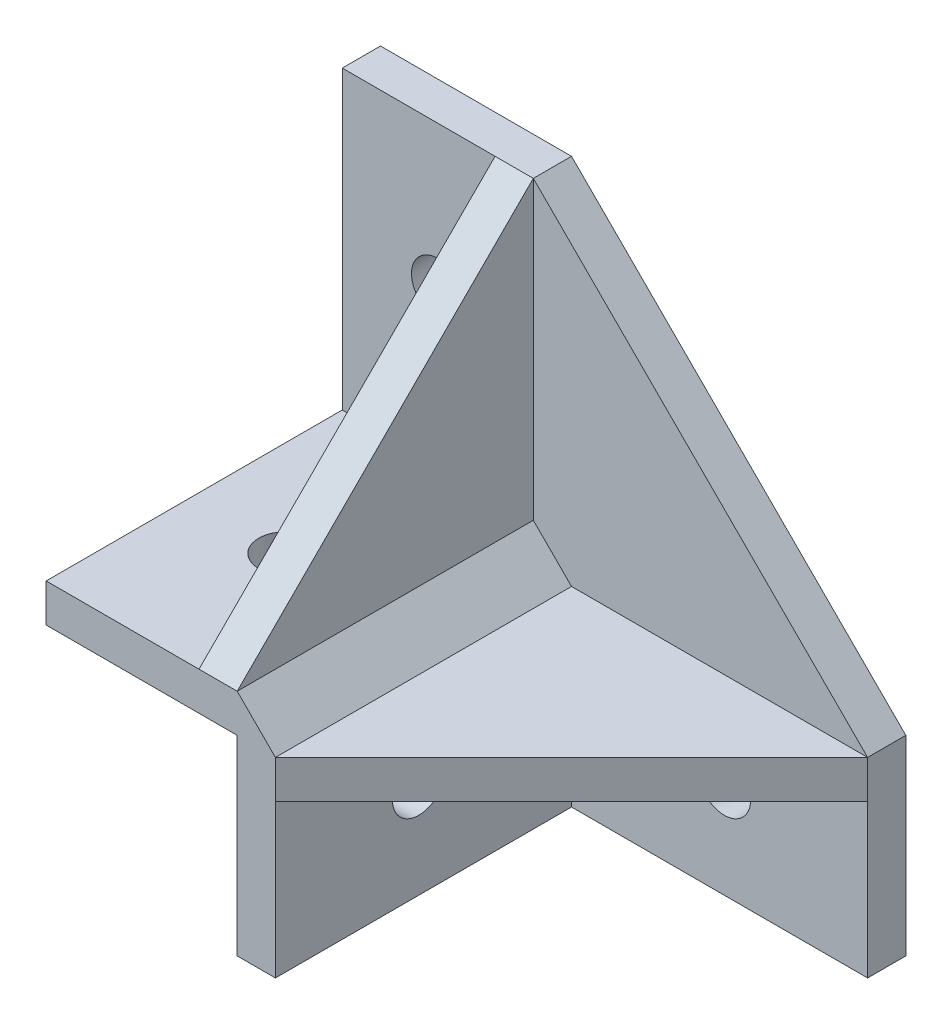
from build123d import *

# Parameters (mm, degrees)
BOSS_EXTRUDE1_DEPTH = 4
BOSS_EXTRUDE2_DEPTH = 31
CHAMFER2_SIZE       = 31
CUT_EXTRUDE1_REACH  = 62.622
SKETCH3_R           = 2.75
CUT_EXTRUDE2_REACH  = 62.622
SKETCH4_R           = 2.75
CUT_EXTRUDE3_REACH  = 62.622
SKETCH5_R           = 2.75


with BuildPart() as part:
    # Sketch1 → Boss-Extrude1 (new body)
    with BuildSketch(Plane.XY):
        Polygon((0, 35), (35, 0), (35, -20), (0, -20), (0, 0), (-20, 0), (-20, 35), align=None)
    extrude(amount=BOSS_EXTRUDE1_DEPTH)

    # Sketch2 → Boss-Extrude2 (add)
    with BuildSketch(Plane.XY.offset(4)):
        Polygon((-20, 0), (0, 0), (0, -20), (4, -20), (4, -4), (35, -4), (35, 0), (4, 0), (0, 4), (0, 35), (-4, 35), (-4, 4), (-20, 4), align=None)
    extrude(amount=BOSS_EXTRUDE2_DEPTH)

    # Chamfer2
    chamfer2_edges = [part.edges().sort_by_distance(p)[0] for p in [
        (-2, 35, 35),
        (35, -2, 35),
    ]]
    chamfer(chamfer2_edges, length=CHAMFER2_SIZE)

    # Sketch3 → Cut-Extrude1 (cut, up to next)
    with BuildSketch(Plane(origin=(0, 0, 0), x_dir=(-1, 0, 0), z_dir=(0, 0, -1)), mode=Mode.PRIVATE) as cut_extrude1_sk1:
        with Locations((10, 20)):
            Circle(SKETCH3_R)
    cut_extrude1_tool1 = extrude(cut_extrude1_sk1.sketch, amount=-CUT_EXTRUDE1_REACH, mode=Mode.PRIVATE) & part.part
    # Sketch3 → Cut-Extrude1 (cut, up to next)
    with BuildSketch(Plane(origin=(0, 0, 0), x_dir=(-1, 0, 0), z_dir=(0, 0, -1)), mode=Mode.PRIVATE) as cut_extrude1_sk2:
        with Locations((-20, -10)):
            Circle(SKETCH3_R)
    cut_extrude1_tool2 = extrude(cut_extrude1_sk2.sketch, amount=-CUT_EXTRUDE1_REACH, mode=Mode.PRIVATE) & part.part
    add(cut_extrude1_tool1.solids().sort_by_distance((-10, 20, 0))[0], mode=Mode.SUBTRACT)
    add(cut_extrude1_tool2.solids().sort_by_distance((20, -10, 0))[0], mode=Mode.SUBTRACT)

    # Sketch4 → Cut-Extrude2 (cut, up to next)
    with BuildSketch(Plane.XZ, mode=Mode.PRIVATE) as cut_extrude2_sk1:
        with Locations(Location((-10, 20, 0), (0, 0, 270))):
            Circle(SKETCH4_R)
    cut_extrude2_tool1 = extrude(cut_extrude2_sk1.sketch, amount=-CUT_EXTRUDE2_REACH, mode=Mode.PRIVATE) & part.part
    add(cut_extrude2_tool1.solids().sort_by_distance((-10, 0, 20))[0], mode=Mode.SUBTRACT)

    # Sketch5 → Cut-Extrude3 (cut, up to next)
    with BuildSketch(Plane.ZY, mode=Mode.PRIVATE) as cut_extrude3_sk1:
        with Locations((20, -10)):
            Circle(SKETCH5_R)
    cut_extrude3_tool1 = extrude(cut_extrude3_sk1.sketch, amount=-CUT_EXTRUDE3_REACH, mode=Mode.PRIVATE) & part.part
    add(cut_extrude3_tool1.solids().sort_by_distance((0, -10, 20))[0], mode=Mode.SUBTRACT)


solid = part.part
